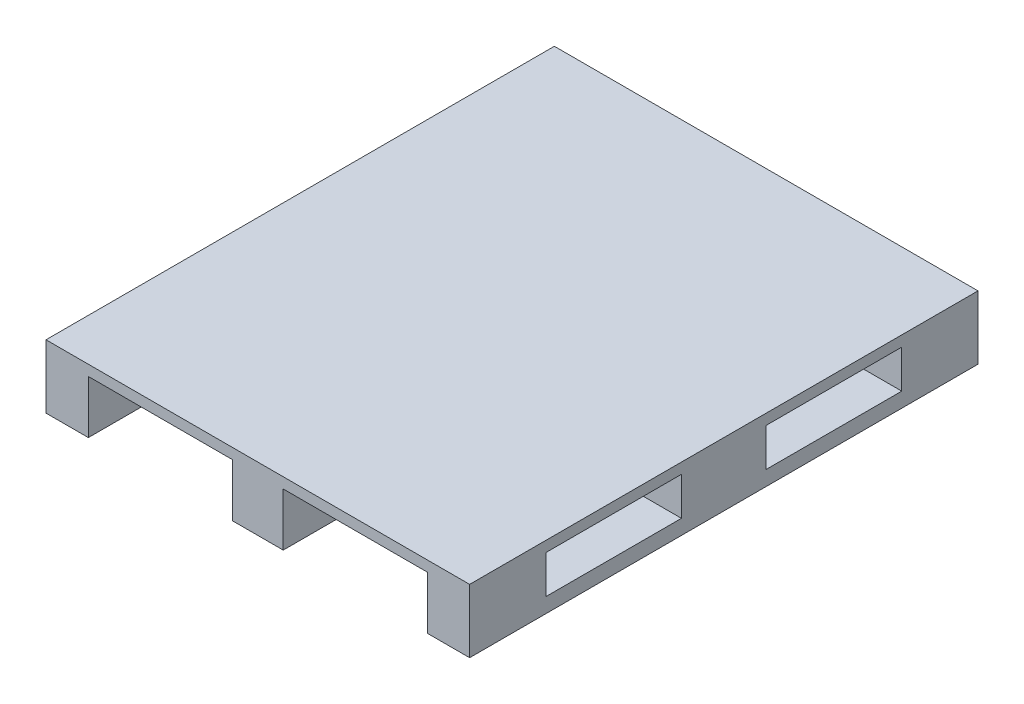
from build123d import *

# Parameters (mm, degrees)
SKETCH_1_W          = 1000
SKETCH_1_H          = 1200
EXTRUDE_1_DEPTH     = 75
CUT_EXTRUDE_1_REACH = 1304.162
SKETCH_2_W          = 340
SKETCH_2_H          = 125
SKETCH_3_W          = 320
SKETCH_3_H          = 90
CUT_EXTRUDE_2_DEPTH = 1169.599589252


with BuildPart() as part:
    # 草图1 → 凸台-拉伸1 (new, symmetric)
    with BuildSketch(Plane(origin=(0, 0, 0), x_dir=(1, 0, 0), z_dir=(0, 1, 0))):
        Rectangle(SKETCH_1_W, SKETCH_1_H)
    extrude(amount=EXTRUDE_1_DEPTH, both=True)

    # 草图2 → 切除-拉伸1 (cut, up to next)
    with BuildSketch(Plane.XY.offset(600), mode=Mode.PRIVATE) as cut_extrude_1_sk1:
        with Locations((-230, -12.5)):
            Rectangle(SKETCH_2_W, SKETCH_2_H)
    cut_extrude_1_tool1 = extrude(cut_extrude_1_sk1.sketch, amount=-CUT_EXTRUDE_1_REACH, mode=Mode.PRIVATE) & part.part
    # 草图2 → 切除-拉伸1 (cut, up to next)
    with BuildSketch(Plane.XY.offset(600), mode=Mode.PRIVATE) as cut_extrude_1_sk2:
        with Locations((230, -12.5)):
            Rectangle(SKETCH_2_W, SKETCH_2_H)
    cut_extrude_1_tool2 = extrude(cut_extrude_1_sk2.sketch, amount=-CUT_EXTRUDE_1_REACH, mode=Mode.PRIVATE) & part.part
    add(cut_extrude_1_tool1.solids().sort_by_distance((-230, -12.5, 600))[0], mode=Mode.SUBTRACT)
    add(cut_extrude_1_tool2.solids().sort_by_distance((230, -12.5, 600))[0], mode=Mode.SUBTRACT)

    # 草图3 → 切除-拉伸2 (cut, through all)
    with BuildSketch(Plane.ZY.offset(500)):
        with Locations((260, 5)):
            Rectangle(SKETCH_3_W, SKETCH_3_H)
        with Locations((-260, 5)):
            Rectangle(SKETCH_3_W, SKETCH_3_H)
    extrude(amount=-CUT_EXTRUDE_2_DEPTH, mode=Mode.SUBTRACT)


solid = part.part
